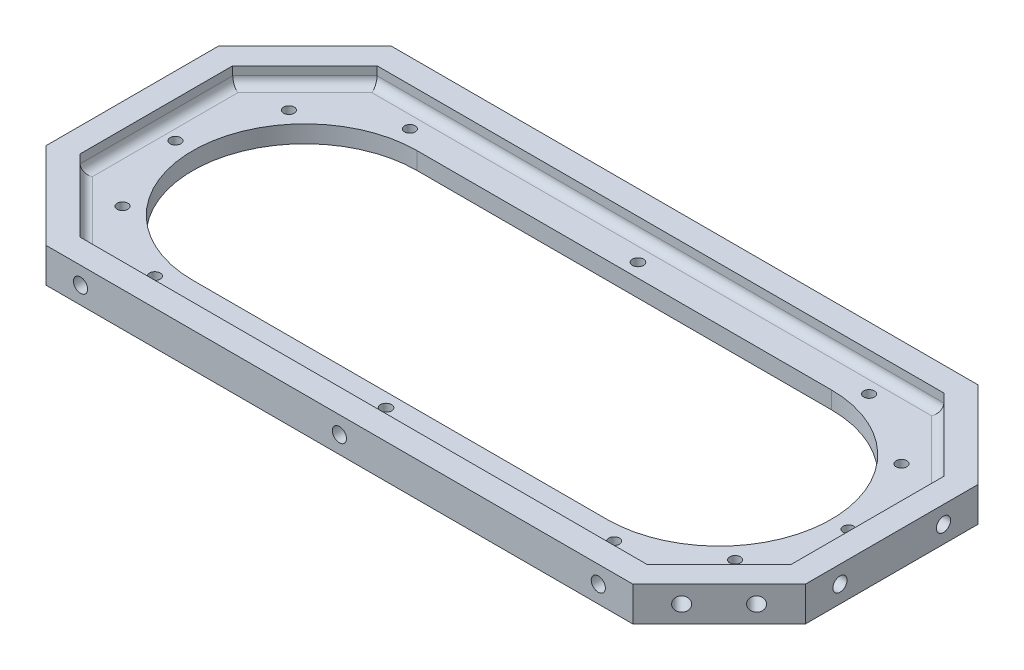
from build123d import *

# Parameters (mm, degrees)
MAIN_DEPTH                                     = 10
SKETCH3_R                                      = 1.55
ACTUATOR_SCREW_HOLE_DEPTH                      = 141.91220671
ACTUATOR_SCREW_HOLE_PATTERN_COUNT              = 3
ACTUATOR_SCREW_HOLE_PATTERN_ANGLE              = 80
ACTUATOR_SCREW_HOLE_PATTERN_THE_OTHER_WA_COUNT = 3
ACTUATOR_SCREW_HOLE_PATTERN_THE_OTHER_WA_ANGLE = 80
DISH_DEPTH                                     = 5
DISH_FILLET_R                                  = 2.5
F_4_0MM_DOWEL_HOLE1_D                          = 4.1
F_4_0MM_DOWEL_HOLE1_DEPTH                      = 5.7
F_4_0MM_DOWEL_HOLE1_ON_FACE_2_D                = 4.1
F_4_0MM_DOWEL_HOLE1_ON_FACE_2_DEPTH            = 5.7
F_4_0MM_DOWEL_HOLE1_ON_FACE_3_D                = 4.1
F_4_0MM_DOWEL_HOLE1_ON_FACE_3_DEPTH            = 5.7
F_4_0MM_DOWEL_HOLE1_ON_FACE_4_D                = 4.1
F_4_0MM_DOWEL_HOLE1_ON_FACE_4_DEPTH            = 5.7
F_4_0MM_DOWEL_HOLE1_ON_FACE_5_D                = 4.1
F_4_0MM_DOWEL_HOLE1_ON_FACE_5_DEPTH            = 5.7
F_4_0MM_DOWEL_HOLE1_ON_FACE_6_D                = 4.1
F_4_0MM_DOWEL_HOLE1_ON_FACE_6_DEPTH            = 5.7
F_4_0MM_DOWEL_HOLE1_ON_FACE_7_D                = 4.1
F_4_0MM_DOWEL_HOLE1_ON_FACE_7_DEPTH            = 5.7
F_4_0MM_DOWEL_HOLE1_ON_FACE_8_D                = 4.1
F_4_0MM_DOWEL_HOLE1_ON_FACE_8_DEPTH            = 5.7
F_4_0MM_DOWEL_HOLE1_ON_FACE_9_D                = 4.1
F_4_0MM_DOWEL_HOLE1_ON_FACE_9_DEPTH            = 5.7
F_4_0MM_DOWEL_HOLE1_ON_FACE_10_D               = 4.1
F_4_0MM_DOWEL_HOLE1_ON_FACE_10_DEPTH           = 5.7
SKETCH14_R                                     = 1.6
COVER_SRCREWHOLES_DEPTH                        = 141.91220671


with BuildPart() as part:
    # Sketch1 → Main (new body)
    with BuildSketch(Plane(origin=(0, 0, 0), x_dir=(1, 0, 0), z_dir=(0, 1, 0))):
        with BuildLine():
            Line((85, 12.5), (0, 12.5))
            Line((0, 12.5), (0, 0))
            Line((0, 0), (0, -5))
            Line((0, -5), (60, -5))
            ThreePointArc((60, -5), (92.5, -37.5), (60, -70))
            Line((60, -70), (0, -70))
            Line((0, -70), (0, -75))
            Line((0, -75), (0, -87.5))
            Line((0, -87.5), (85, -87.5))
            Line((85, -87.5), (110, -62.5))
            Line((110, -62.5), (110, -12.5))
            Line((110, -12.5), (85, 12.5))
        make_face()
    extrude(amount=MAIN_DEPTH)

    # Sketch3 → Actuator Screw Hole (cut, through all)
    with BuildSketch(Plane(origin=(0, 10, 0), x_dir=(1, 0, 0), z_dir=(0, 1, 0))):
        with Locations(Location((97.5, -37.5, 0), (0, 0, 270))):
            Circle(SKETCH3_R)
    actuator_screw_hole = extrude(amount=-ACTUATOR_SCREW_HOLE_DEPTH, mode=Mode.SUBTRACT)

    # Actuator Screw Hole Pattern: Actuator Screw Hole ×3 about axis
    actuator_screw_hole_pattern_axis = Axis((60, 0, 37.5), (0, 1, 0))
    for i in range(1, ACTUATOR_SCREW_HOLE_PATTERN_COUNT):
        add(actuator_screw_hole.rotate(actuator_screw_hole_pattern_axis, i * ACTUATOR_SCREW_HOLE_PATTERN_ANGLE / (ACTUATOR_SCREW_HOLE_PATTERN_COUNT - 1)), mode=Mode.SUBTRACT)

    # Actuator Screw Hole Pattern the other wa: Actuator Screw Hole ×3 about axis
    actuator_screw_hole_pattern_the_other_wa_axis = Axis((60, 0, 37.5), (0, -1, 0))
    for i in range(1, ACTUATOR_SCREW_HOLE_PATTERN_THE_OTHER_WA_COUNT):
        add(actuator_screw_hole.rotate(actuator_screw_hole_pattern_the_other_wa_axis, i * ACTUATOR_SCREW_HOLE_PATTERN_THE_OTHER_WA_ANGLE / (ACTUATOR_SCREW_HOLE_PATTERN_THE_OTHER_WA_COUNT - 1)), mode=Mode.SUBTRACT)

    # Mirror1: part across plane


with BuildPart() as part_1:
    add(part.part)
    add(part.part.mirror(Plane(origin=(0, 0, 0), x_dir=(0, 0, 1), z_dir=(1, 0, 0))))

    # Sketch8 → Dish (cut)
    with BuildSketch(Plane(origin=(0, 10, 0), x_dir=(1, 0, 0), z_dir=(0, 1, 0))):
        Polygon((82.100505063, 5.5), (-82.100505063, 5.5), (-103, -15.399494937), (-103, -59.600505063), (-82.100505063, -80.5), (82.100505063, -80.5), (103, -59.600505063), (103, -15.399494937), align=None)
    extrude(amount=-DISH_DEPTH, mode=Mode.SUBTRACT)

    # Dish fillet
    dish_fillet_edges = [part_1.edges().sort_by_distance(p)[0] for p in [
        (92.550252532, 5, 4.949747468),
        (103, 5, 37.5),
        (92.550252532, 5, 70.050252532),
        (0, 5, 80.5),
        (-92.550252532, 5, 70.050252532),
        (-103, 5, 37.5),
        (-92.550252532, 5, 4.949747468),
        (0, 5, -5.5),
    ]]
    fillet(dish_fillet_edges, radius=DISH_FILLET_R)

    # Ø4.0mm Dowel Hole1
    with Locations(Plane(origin=(75, 5, -12.5), x_dir=(-1, 0, 0), z_dir=(0, 0, -1))):
        with Locations((0, 0), (75, 0), (150, 0)):
            Hole(F_4_0MM_DOWEL_HOLE1_D / 2, depth=F_4_0MM_DOWEL_HOLE1_DEPTH)

    # Ø4.0mm Dowel Hole1 on face 2
    with Locations(Plane(origin=(-92.071067812, 5, -5.428932188), x_dir=(-0.707106781187, 0, 0.707106781187), z_dir=(-0.707106781187, 0, -0.707106781187))):
        with Locations((0, 0), (15.355339059, 0)):
            Hole(F_4_0MM_DOWEL_HOLE1_ON_FACE_2_D / 2, depth=F_4_0MM_DOWEL_HOLE1_ON_FACE_2_DEPTH)

    # Ø4.0mm Dowel Hole1 on face 3
    with Locations(Plane(origin=(-110, 5, 22.5), x_dir=(0, 0, -1), z_dir=(-1, 0, 0))):
        with Locations((0, 0), (-30, 0)):
            Hole(F_4_0MM_DOWEL_HOLE1_ON_FACE_3_D / 2, depth=F_4_0MM_DOWEL_HOLE1_ON_FACE_3_DEPTH)

    # Ø4.0mm Dowel Hole1 on face 4
    with Locations(Plane(origin=(-102.928932188, 5, 69.571067812), x_dir=(0.707106781187, 0, 0.707106781187), z_dir=(-0.707106781187, 0, 0.707106781187))):
        with Locations((0, 0)):
            Hole(F_4_0MM_DOWEL_HOLE1_ON_FACE_4_D / 2, depth=F_4_0MM_DOWEL_HOLE1_ON_FACE_4_DEPTH)

    # Ø4.0mm Dowel Hole1 on face 5
    with Locations(Plane(origin=(-92.071067812, 5, 80.428932188), x_dir=(0.707106781187, 0, 0.707106781187), z_dir=(-0.707106781187, 0, 0.707106781187))):
        with Locations((0, 0)):
            Hole(F_4_0MM_DOWEL_HOLE1_ON_FACE_5_D / 2, depth=F_4_0MM_DOWEL_HOLE1_ON_FACE_5_DEPTH)

    # Ø4.0mm Dowel Hole1 on face 6
    with Locations(Plane(origin=(-75, 5, 87.5), x_dir=(1, 0, 0), z_dir=(0, 0, 1))):
        with Locations((0, 0), (75, 0), (150, 0)):
            Hole(F_4_0MM_DOWEL_HOLE1_ON_FACE_6_D / 2, depth=F_4_0MM_DOWEL_HOLE1_ON_FACE_6_DEPTH)

    # Ø4.0mm Dowel Hole1 on face 7
    with Locations(Plane(origin=(92.071067812, 5, 80.428932188), x_dir=(0.707106781187, 0, -0.707106781187), z_dir=(0.707106781187, 0, 0.707106781187))):
        with Locations((0, 0)):
            Hole(F_4_0MM_DOWEL_HOLE1_ON_FACE_7_D / 2, depth=F_4_0MM_DOWEL_HOLE1_ON_FACE_7_DEPTH)

    # Ø4.0mm Dowel Hole1 on face 8
    with Locations(Plane(origin=(102.928932188, 5, 69.571067812), x_dir=(0.707106781187, 0, -0.707106781187), z_dir=(0.707106781187, 0, 0.707106781187))):
        with Locations((0, 0)):
            Hole(F_4_0MM_DOWEL_HOLE1_ON_FACE_8_D / 2, depth=F_4_0MM_DOWEL_HOLE1_ON_FACE_8_DEPTH)

    # Ø4.0mm Dowel Hole1 on face 9
    with Locations(Plane(origin=(110, 5, 52.5), x_dir=(0, 0, 1), z_dir=(1, 0, 0))):
        with Locations((0, 0), (-30, 0)):
            Hole(F_4_0MM_DOWEL_HOLE1_ON_FACE_9_D / 2, depth=F_4_0MM_DOWEL_HOLE1_ON_FACE_9_DEPTH)

    # Ø4.0mm Dowel Hole1 on face 10
    with Locations(Plane(origin=(102.928932188, 5, 5.428932188), x_dir=(-0.707106781187, 0, -0.707106781187), z_dir=(0.707106781187, 0, -0.707106781187))):
        with Locations((0, 0), (15.355339059, 0)):
            Hole(F_4_0MM_DOWEL_HOLE1_ON_FACE_10_D / 2, depth=F_4_0MM_DOWEL_HOLE1_ON_FACE_10_DEPTH)

    # Sketch14 → Cover srcrewholes (cut, through all)
    with BuildSketch(Plane.XZ):
        with Locations(Location((0, 1, 0), (0, 0, 270))):
            Circle(SKETCH14_R)
        with Locations(Location((0, 74, 0), (0, 0, 270))):
            Circle(SKETCH14_R)
    extrude(amount=-COVER_SRCREWHOLES_DEPTH, mode=Mode.SUBTRACT)


solid = part_1.part
